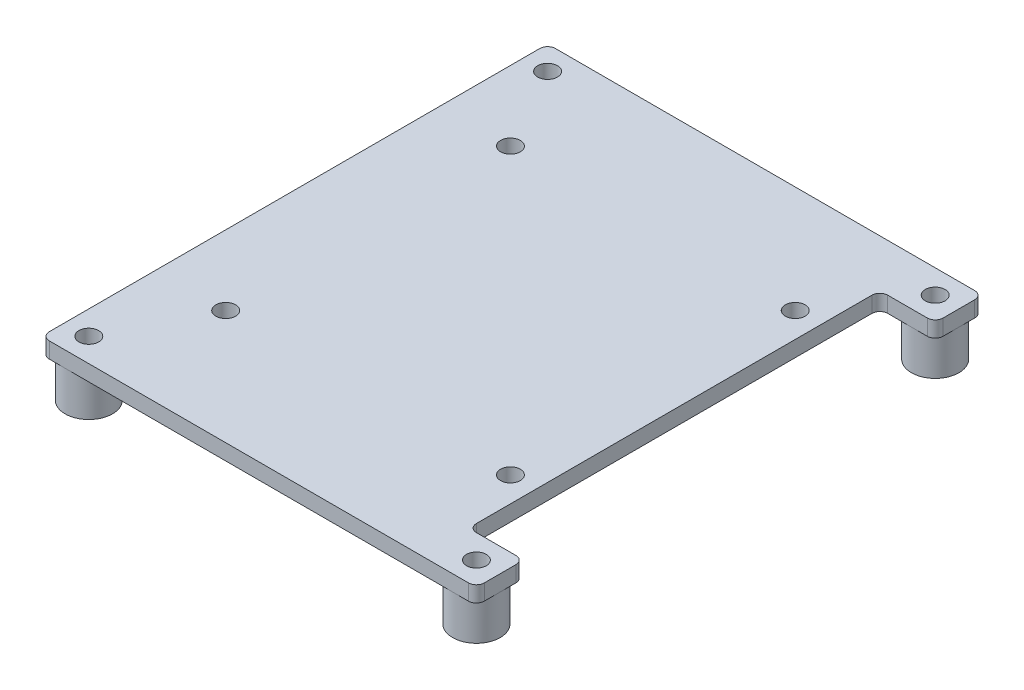
from build123d import *

# Parameters (mm, degrees)
SKETCH2_W           = 55
SKETCH2_H           = 64
SKETCH2_R           = 1.25
SKETCH2_R_2         = 1.249934
BOSS_EXTRUDE1_DEPTH = 2
SKETCH4_W           = 7
SKETCH4_H           = 52
CUT_EXTRUDE1_DEPTH  = 2
FILLET1_R           = 1
BOSS_EXTRUDE2_START = -7
SKETCH5_R           = 3
SKETCH5_R_2         = 1.25
BOSS_EXTRUDE2_DEPTH = 7


with BuildPart() as part:
    # Sketch2 → Boss-Extrude1 (new body)
    with BuildSketch(Plane(origin=(0, 0, 0), x_dir=(1, 0, 0), z_dir=(0, 1, 0))):
        with Locations((18.669829868, -18.471180694)):
            Rectangle(SKETCH2_W, SKETCH2_H)
        with Locations(Location((-5.830170132, 10.528819306, 0), (0, 0, 270))):
            Circle(SKETCH2_R, mode=Mode.SUBTRACT)
        with Locations(Location((-5.830170132, -47.471180694, 0), (0, 0, 270))):
            Circle(SKETCH2_R, mode=Mode.SUBTRACT)
        with Locations(Location((43.169829868, -47.471180694, 0), (0, 0, 270))):
            Circle(SKETCH2_R, mode=Mode.SUBTRACT)
        with Locations(Location((43.169829868, 10.528819306, 0), (0, 0, 270))):
            Circle(SKETCH2_R, mode=Mode.SUBTRACT)
        with Locations(Location((0, 0, 0), (0, 0, 270))):
            Circle(SKETCH2_R_2, mode=Mode.SUBTRACT)
        with Locations(Location((35.999928, 0, 0), (0, 0, 270))):
            Circle(SKETCH2_R_2, mode=Mode.SUBTRACT)
        with Locations(Location((0, -35.999928, 0), (0, 0, 270))):
            Circle(SKETCH2_R_2, mode=Mode.SUBTRACT)
        with Locations(Location((35.999928, -35.999928, 0), (0, 0, 270))):
            Circle(SKETCH2_R_2, mode=Mode.SUBTRACT)
    extrude(amount=BOSS_EXTRUDE1_DEPTH)

    # Sketch4 → Cut-Extrude1 (cut)
    with BuildSketch(Plane(origin=(0, 2, 0), x_dir=(1, 0, 0), z_dir=(0, 1, 0))):
        with Locations((42.669829868, -18.471180694)):
            Rectangle(SKETCH4_W, SKETCH4_H)
    extrude(amount=-CUT_EXTRUDE1_DEPTH, mode=Mode.SUBTRACT)

    # Fillet1
    fillet1_edges = [part.edges().sort_by_distance(p)[0] for p in [
        (46.169829868, 1, -13.528819306),
        (46.169829868, 1, 50.471180694),
        (-8.830170132, 1, 50.471180694),
        (-8.830170132, 1, -13.528819306),
        (46.169829868, 1, -7.528819306),
        (46.169829868, 1, 44.471180694),
        (39.169829868, 1, 44.471180694),
        (39.169829868, 1, -7.528819306),
    ]]
    fillet(fillet1_edges, radius=FILLET1_R)

    # Sketch5 → Boss-Extrude2 (add)
    # profile 1 of 4: a face of its own
    with BuildSketch(Plane(origin=(0, 2, 0), x_dir=(1, 0, 0), z_dir=(0, 1, 0)).offset(BOSS_EXTRUDE2_START)):
        with Locations(Location((-5.830170132, 10.528819306, 0), (0, 0, 270))):
            Circle(SKETCH5_R)
        with Locations(Location((-5.830170132, 10.528819306, 0), (0, 0, 270))):
            Circle(SKETCH5_R_2, mode=Mode.SUBTRACT)
    # profile 2 of 4: a face of its own
    with BuildSketch(Plane(origin=(0, 2, 0), x_dir=(1, 0, 0), z_dir=(0, 1, 0)).offset(BOSS_EXTRUDE2_START)):
        with Locations(Location((43.169829868, 10.528819306, 0), (0, 0, 270))):
            Circle(SKETCH5_R)
        with Locations(Location((43.169829868, 10.528819306, 0), (0, 0, 270))):
            Circle(SKETCH5_R_2, mode=Mode.SUBTRACT)
    # profile 3 of 4: a face of its own
    with BuildSketch(Plane(origin=(0, 2, 0), x_dir=(1, 0, 0), z_dir=(0, 1, 0)).offset(BOSS_EXTRUDE2_START)):
        with Locations(Location((43.169829868, -47.471180694, 0), (0, 0, 270))):
            Circle(SKETCH5_R)
        with Locations(Location((43.169829868, -47.471180694, 0), (0, 0, 270))):
            Circle(SKETCH5_R_2, mode=Mode.SUBTRACT)
    # profile 4 of 4: a face of its own
    with BuildSketch(Plane(origin=(0, 2, 0), x_dir=(1, 0, 0), z_dir=(0, 1, 0)).offset(BOSS_EXTRUDE2_START)):
        with Locations(Location((-5.830170132, -47.471180694, 0), (0, 0, 270))):
            Circle(SKETCH5_R)
        with Locations(Location((-5.830170132, -47.471180694, 0), (0, 0, 270))):
            Circle(SKETCH5_R_2, mode=Mode.SUBTRACT)
    extrude(amount=BOSS_EXTRUDE2_DEPTH)


solid = part.part
